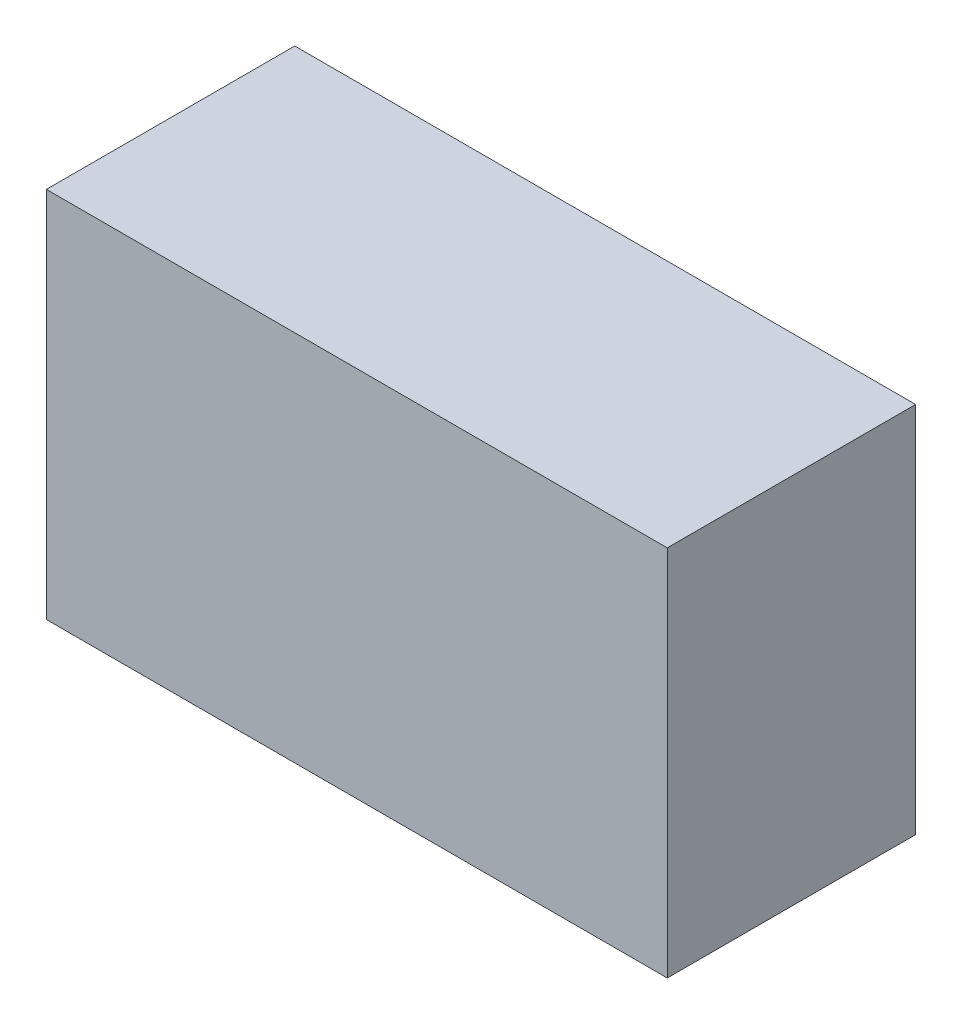
from build123d import *

# Parameters (mm, degrees)
SKETCH_1_W      = 25
SKETCH_1_H      = 15
EXTRUDE_1_DEPTH = 10
SCALE_1_SCALE   = 0.1


with BuildPart() as part:
    # 草图1 → 凸台-拉伸1 (new body)
    with BuildSketch(Plane.XY):
        with Locations((8.3125, 3.65625)):
            Rectangle(SKETCH_1_W, SKETCH_1_H)
    extrude(amount=EXTRUDE_1_DEPTH)


with BuildPart() as part_1:
    # 缩放比例1: scaled about (8.3125, 3.65625, 5)
    add(part.part.scale(SCALE_1_SCALE).moved(Location((7.48125, 3.290625, 4.5))))


solid = part_1.part
